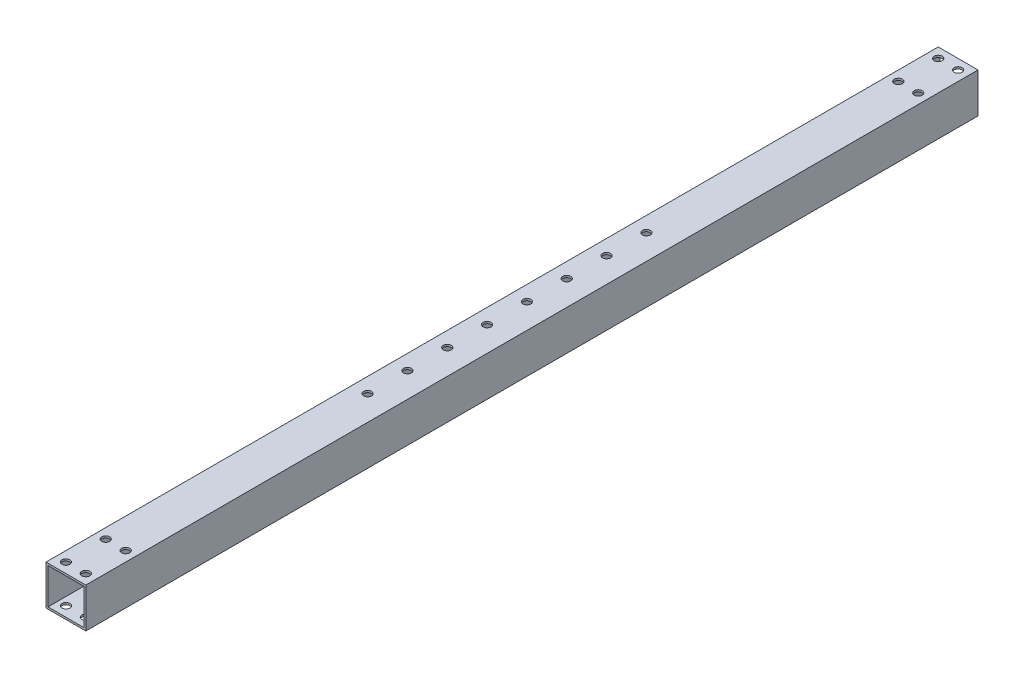
from build123d import *

# Parameters (mm, degrees)
SKETCH_1_W          = 20
SKETCH_1_H          = 20
SKETCH_1_W_2        = 18
SKETCH_1_H_2        = 18
EXTRUDE_1_DEPTH     = 448
SKETCH_4_R          = 2
CUT_EXTRUDE_1_DEPTH = 449.891969186


with BuildPart() as part:
    # 草图1 → 拉伸-薄壁1 (new body)
    with BuildSketch(Plane.XY):
        with Locations((10, 10)):
            Rectangle(SKETCH_1_W, SKETCH_1_H)
        with Locations((10, 10)):
            Rectangle(SKETCH_1_W_2, SKETCH_1_H_2, mode=Mode.SUBTRACT)
    extrude(amount=EXTRUDE_1_DEPTH)

    # 草图4 → 切除-拉伸1 (cut, through all)
    with BuildSketch(Plane(origin=(0, 20, 0), x_dir=(1, 0, 0), z_dir=(0, 1, 0))):
        with Locations(Location((5, -423, 0), (0, 0, 270))):
            Circle(SKETCH_4_R)
        with Locations(Location((15, -423, 0), (0, 0, 270))):
            Circle(SKETCH_4_R)
        with Locations(Location((15, -443, 0), (0, 0, 270))):
            Circle(SKETCH_4_R)
        with Locations(Location((5, -443, 0), (0, 0, 270))):
            Circle(SKETCH_4_R)
        with Locations(Location((5, -5, 0), (0, 0, 90))):
            Circle(SKETCH_4_R)
        with Locations(Location((15, -5, 0), (0, 0, 90))):
            Circle(SKETCH_4_R)
        with Locations(Location((15, -25, 0), (0, 0, 90))):
            Circle(SKETCH_4_R)
        with Locations(Location((5, -25, 0), (0, 0, 90))):
            Circle(SKETCH_4_R)
        with Locations(Location((7.5, -154, 0), (0, 0, 270))):
            Circle(SKETCH_4_R)
        with Locations(Location((7.5, -174, 0), (0, 0, 270))):
            Circle(SKETCH_4_R)
        with Locations(Location((7.5, -194, 0), (0, 0, 270))):
            Circle(SKETCH_4_R)
        with Locations(Location((7.5, -214, 0), (0, 0, 270))):
            Circle(SKETCH_4_R)
        with Locations(Location((7.5, -234, 0), (0, 0, 90))):
            Circle(SKETCH_4_R)
        with Locations(Location((7.5, -254, 0), (0, 0, 90))):
            Circle(SKETCH_4_R)
        with Locations(Location((7.5, -274, 0), (0, 0, 90))):
            Circle(SKETCH_4_R)
        with Locations(Location((7.5, -294, 0), (0, 0, 90))):
            Circle(SKETCH_4_R)
    extrude(amount=-CUT_EXTRUDE_1_DEPTH, mode=Mode.SUBTRACT)


solid = part.part
